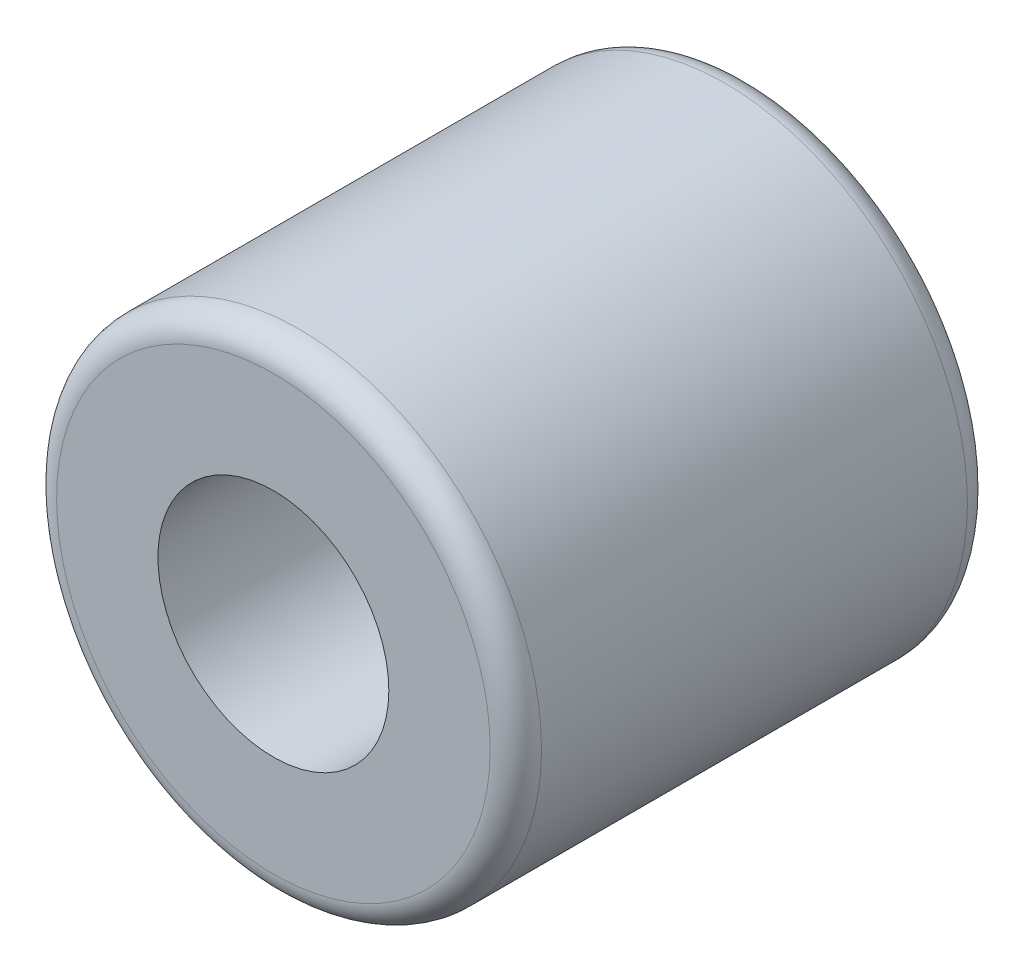
from build123d import *

# Parameters (mm, degrees)
SKETCH_1_R      = 9.45
SKETCH_1_R_2    = 4.5
EXTRUDE_1_DEPTH = 18.6
FILLET_1_R      = 1


with BuildPart() as part:
    # ｽｹｯﾁ1 → ﾎﾞｽ - 押し出し1 (new body)
    with BuildSketch(Plane.XY):
        Circle(SKETCH_1_R)
        Circle(SKETCH_1_R_2, mode=Mode.SUBTRACT)
    extrude(amount=EXTRUDE_1_DEPTH)

    # ﾌｨﾚｯﾄ1
    fillet_1_edges = [part.edges().sort_by_distance(p)[0] for p in [
        (-9.45, 0, 0),
        (-9.45, 0, 18.6),
    ]]
    fillet(fillet_1_edges, radius=FILLET_1_R)


solid = part.part
